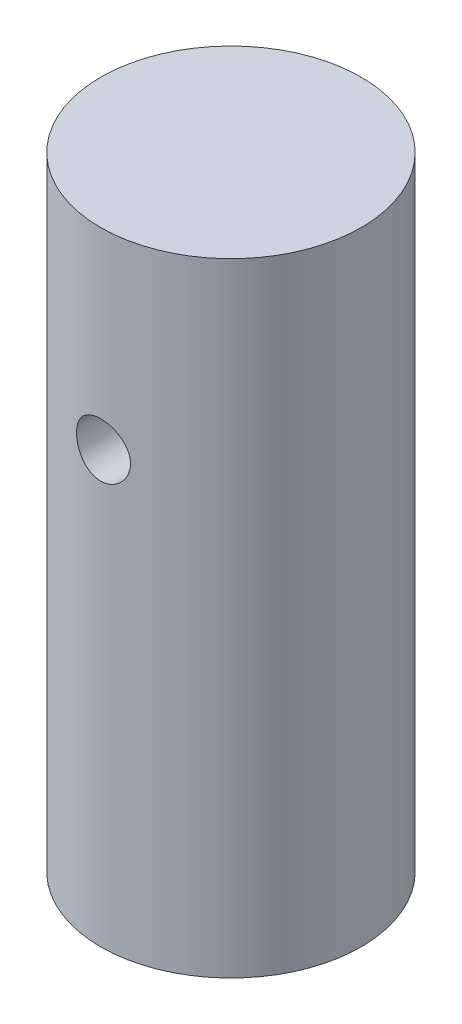
from build123d import *

# Parameters (mm, degrees)
SKETCH1_R           = 23
BOSS_EXTRUDE1_DEPTH = 110
SKETCH2_R           = 4.7625
CUT_EXTRUDE1_DEPTH  = 25


with BuildPart() as part:
    # Sketch1 → Boss-Extrude1 (new body)
    with BuildSketch(Plane(origin=(0, 0, 0), x_dir=(1, 0, 0), z_dir=(0, 1, 0))):
        with Locations(Location((0, 0, 0), (0, 0, 270))):
            Circle(SKETCH1_R)
    extrude(amount=BOSS_EXTRUDE1_DEPTH)

    # Sketch2 → Cut-Extrude1 (cut, symmetric)
    with BuildSketch(Plane.XY):
        with Locations(Location((0, 76, 0), (0, 0, 90.000000049))):
            Circle(SKETCH2_R)
    extrude(amount=CUT_EXTRUDE1_DEPTH, both=True, mode=Mode.SUBTRACT)


solid = part.part
